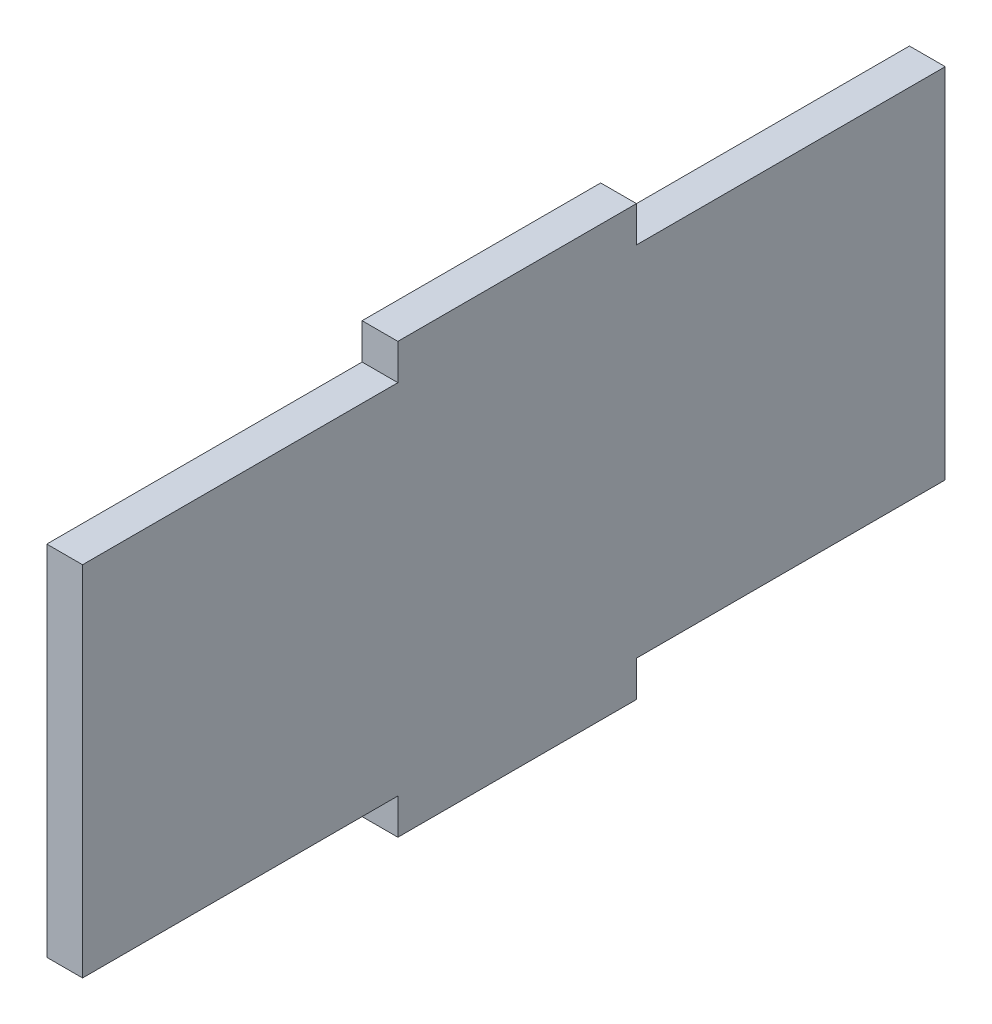
from build123d import *

# Parameters (mm, degrees)
SKETCH1_W           = 3
SKETCH1_H           = 20
BOSS_EXTRUDE1_DEPTH = 3
SKETCH2_W           = 3
SKETCH2_H           = 72.31
BOSS_EXTRUDE2_DEPTH = 30
SKETCH3_W           = 3
SKETCH3_H           = 20
BOSS_EXTRUDE3_DEPTH = 3


with BuildPart() as part:
    # Sketch1 → Boss-Extrude1 (new body)
    with BuildSketch(Plane(origin=(0, 0, 0), x_dir=(1, 0, 0), z_dir=(0, 1, 0))):
        with Locations((-4.820734675, -44.391585228)):
            Rectangle(SKETCH1_W, SKETCH1_H)
    extrude(amount=BOSS_EXTRUDE1_DEPTH)

    # Sketch2 → Boss-Extrude2 (add)
    with BuildSketch(Plane(origin=(0, 3, 0), x_dir=(1, 0, 0), z_dir=(0, 1, 0))):
        with Locations((-4.820734675, -44.66687809)):
            Rectangle(SKETCH2_W, SKETCH2_H)
    extrude(amount=BOSS_EXTRUDE2_DEPTH)

    # Sketch3 → Boss-Extrude3 (add)
    with BuildSketch(Plane(origin=(0, 33, 0), x_dir=(1, 0, 0), z_dir=(0, 1, 0))):
        with Locations((-4.820734675, -44.391585228)):
            Rectangle(SKETCH3_W, SKETCH3_H)
    extrude(amount=BOSS_EXTRUDE3_DEPTH)


solid = part.part
